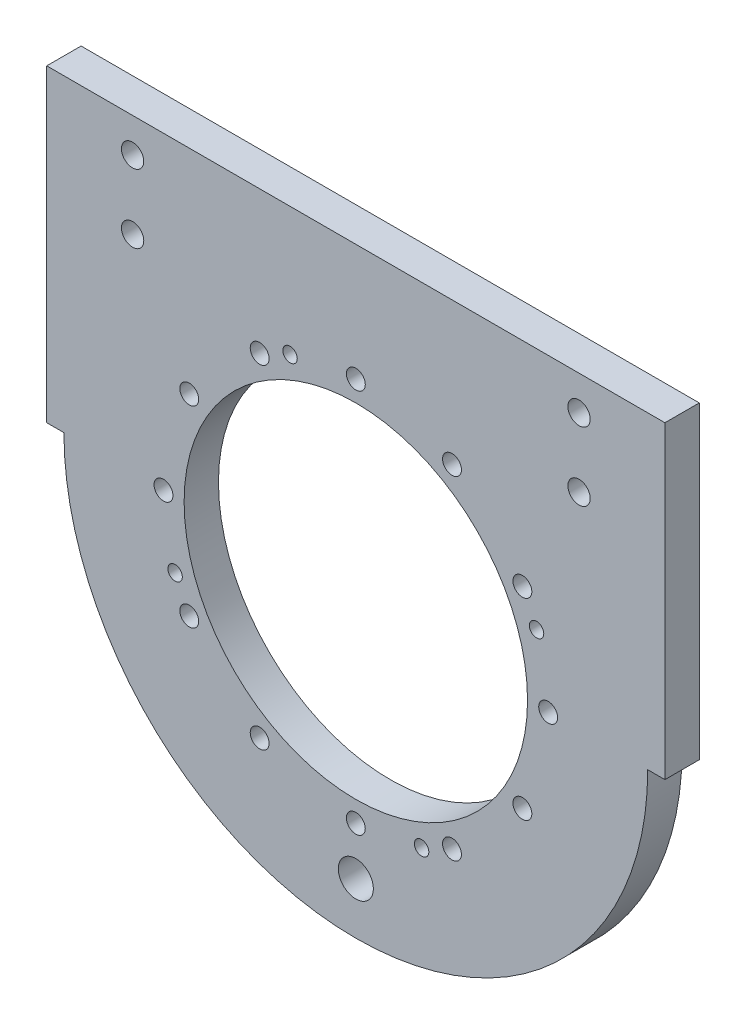
from build123d import *

# Parameters (mm, degrees)
SKETCH_1_R          = 85
EXTRUDE_1_DEPTH     = 10
SKETCH_2_W          = 180
SKETCH_2_H          = 90
EXTRUDE_2_DEPTH     = 10
SKETCH_3_R          = 50
SKETCH_3_R_2        = 2.75
SKETCH_3_R_3        = 2.1
SKETCH_3_R_4        = 5.1
SKETCH_3_R_5        = 3.25
CUT_EXTRUDE_1_DEPTH = 11


with BuildPart() as part:
    # 草图1 → 凸台-拉伸1 (new body)
    with BuildSketch(Plane.XY):
        Circle(SKETCH_1_R)
    extrude(amount=EXTRUDE_1_DEPTH)

    # 草图2 → 凸台-拉伸2 (add)
    with BuildSketch(Plane.XY):
        with Locations((0, 45)):
            Rectangle(SKETCH_2_W, SKETCH_2_H)
    extrude(amount=EXTRUDE_2_DEPTH)

    # 草图3 → 切除-拉伸1 (cut)
    with BuildSketch(Plane(origin=(0, 0, 0), x_dir=(-1, 0, 0), z_dir=(0, 0, -1))):
        Circle(SKETCH_3_R)
        with Locations((-56, 0)):
            Circle(SKETCH_3_R_2)
        with Locations((-48.497422612, 28)):
            Circle(SKETCH_3_R_2)
        with Locations((-28, 48.497422612)):
            Circle(SKETCH_3_R_2)
        with Locations((0, 56)):
            Circle(SKETCH_3_R_2)
        with Locations((28, 48.497422612)):
            Circle(SKETCH_3_R_2)
        with Locations((48.497422612, 28)):
            Circle(SKETCH_3_R_2)
        with Locations((56, 0)):
            Circle(SKETCH_3_R_2)
        with Locations((48.497422612, -28)):
            Circle(SKETCH_3_R_2)
        with Locations((28, -48.497422612)):
            Circle(SKETCH_3_R_2)
        with Locations((0, -56)):
            Circle(SKETCH_3_R_2)
        with Locations((-28, -48.497422612)):
            Circle(SKETCH_3_R_2)
        with Locations((-48.497422612, -28)):
            Circle(SKETCH_3_R_2)
        with Locations((-52.622786764, 19.153128026)):
            Circle(SKETCH_3_R_3)
        with Locations((19.153128026, 52.622786764)):
            Circle(SKETCH_3_R_3)
        with Locations((52.622786764, -19.153128026)):
            Circle(SKETCH_3_R_3)
        with Locations((-19.153128026, -52.622786764)):
            Circle(SKETCH_3_R_3)
        with Locations((0, -70)):
            Circle(SKETCH_3_R_4)
        with Locations((65, 60)):
            Circle(SKETCH_3_R_5)
        with Locations((65, 80)):
            Circle(SKETCH_3_R_5)
        with Locations((-65, 60)):
            Circle(SKETCH_3_R_5)
        with Locations((-65, 80)):
            Circle(SKETCH_3_R_5)
    extrude(amount=-CUT_EXTRUDE_1_DEPTH, mode=Mode.SUBTRACT)


solid = part.part
